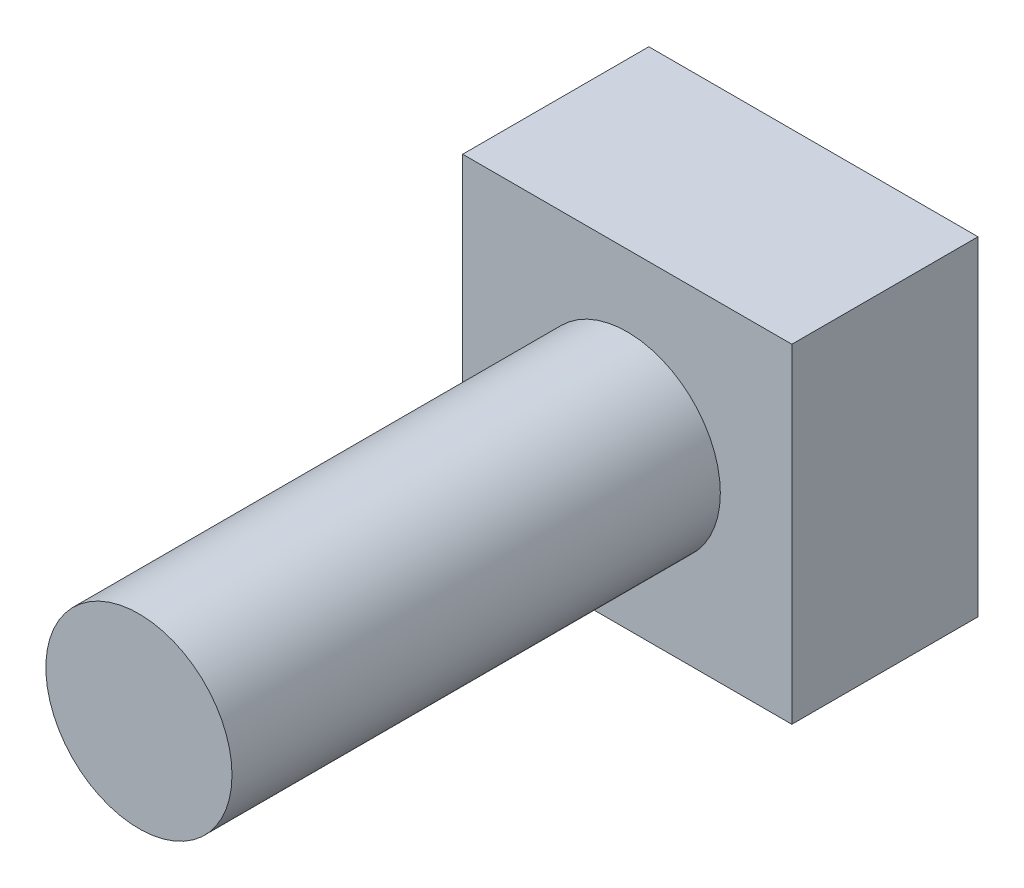
from build123d import *

# Parameters (mm, degrees)
SKETCH1_W           = 6.1976
SKETCH1_H           = 6.1976
BOSS_EXTRUDE1_DEPTH = 3.5052
SKETCH2_R           = 1.7526
BOSS_EXTRUDE2_DEPTH = 9.1948


with BuildPart() as part:
    # Sketch1 → Boss-Extrude1 (new body)
    with BuildSketch(Plane.XY):
        Rectangle(SKETCH1_W, SKETCH1_H)
    extrude(amount=-BOSS_EXTRUDE1_DEPTH)

    # Sketch2 → Boss-Extrude2 (add)
    with BuildSketch(Plane.XY):
        Circle(SKETCH2_R)
    extrude(amount=BOSS_EXTRUDE2_DEPTH)


solid = part.part
